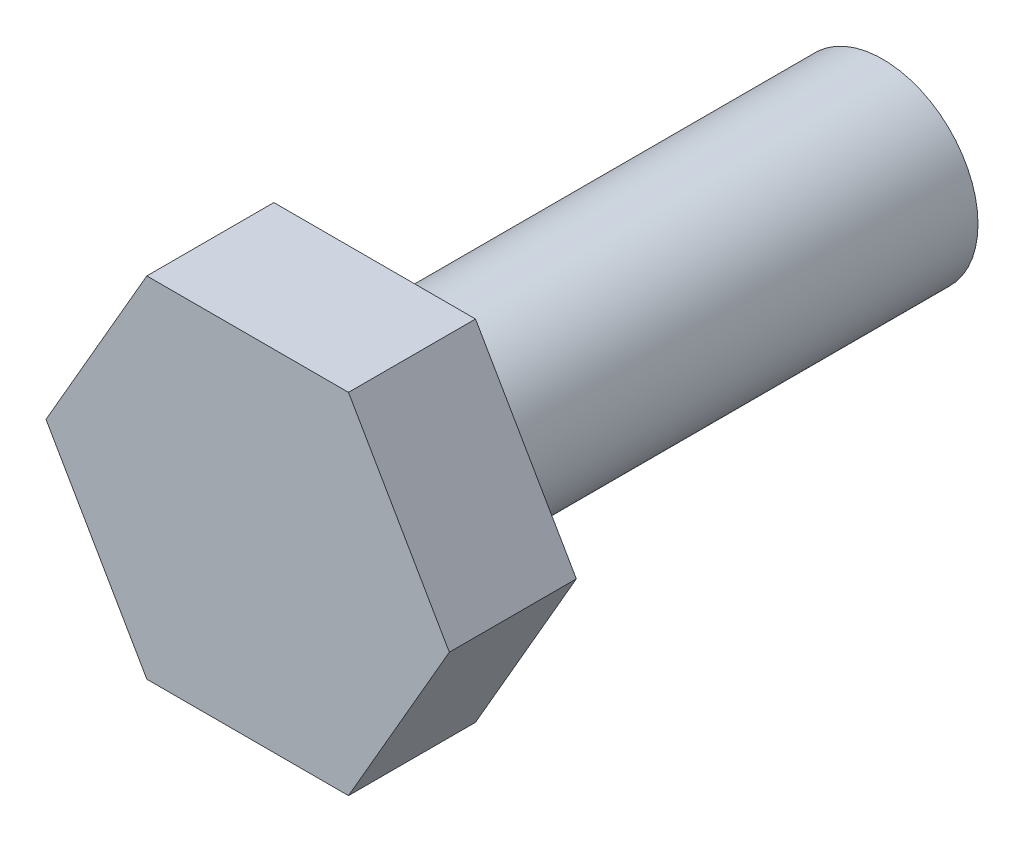
from build123d import *

# Parameters (mm, degrees)
SKETCH1_R      = 1.5
EXTRUDE1_DEPTH = 8
EXTRUDE2_DEPTH = 2


with BuildPart() as part:
    # Sketch1 → Extrude1 (new body)
    with BuildSketch(Plane.XY):
        Circle(SKETCH1_R)
    extrude(amount=-EXTRUDE1_DEPTH)

    # Sketch2 → Extrude2 (add)
    with BuildSketch(Plane.XY):
        Polygon((-1.58771324, 2.75), (-3.175426481, 0), (-1.58771324, -2.75), (1.58771324, -2.75), (3.175426481, 0), (1.58771324, 2.75), align=None)
    extrude(amount=EXTRUDE2_DEPTH)


solid = part.part
